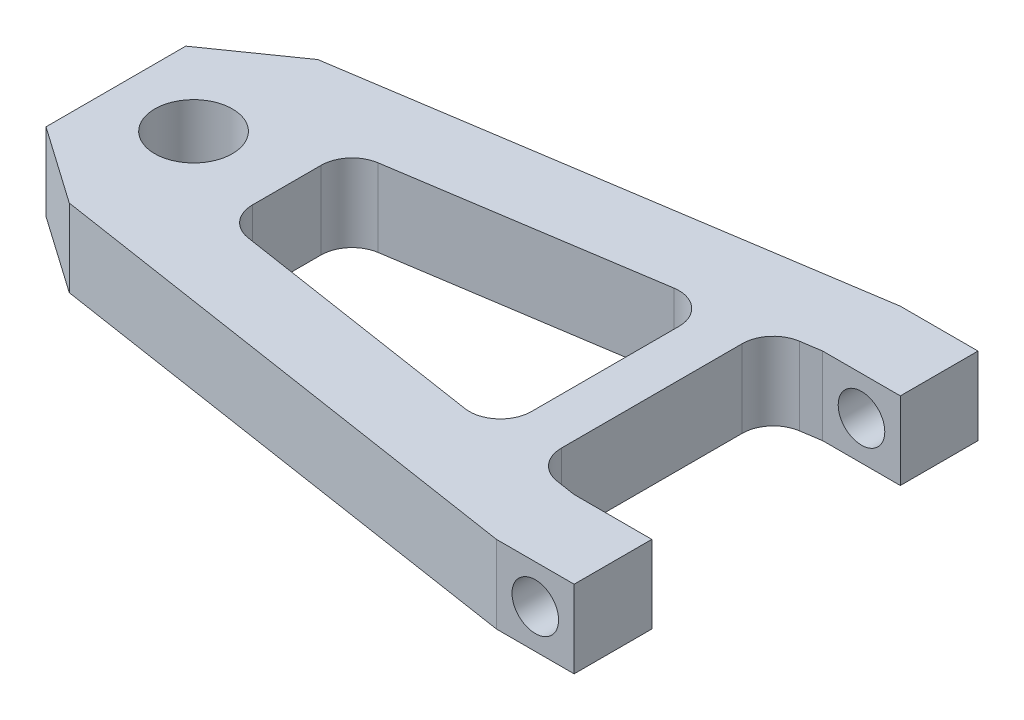
from build123d import *

# Parameters (mm, degrees)
SKETCH1_R           = 2.5
BOSS_EXTRUDE1_DEPTH = 5
SKETCH2_R           = 1.5
CUT_EXTRUDE1_DEPTH  = 46.904792778


with BuildPart() as part:
    # Sketch1 → Boss-Extrude1 (new body)
    with BuildSketch(Plane(origin=(0, 0, 0), x_dir=(1, 0, 0), z_dir=(0, 1, 0))):
        with BuildLine():
            Line((0, 8), (-5, 4.498962309))
            Line((-5, 4.498962309), (-5, -4.498962309))
            Line((-5, -4.498962309), (0, -8))
            Line((0, -8), (32.5, -13))
            Line((32.5, -13), (37.5, -13))
            Line((37.5, -13), (37.5, -8))
            Line((37.5, -8), (32.5, -8))
            Line((32.5, -8), (31.195885631, -7.79936702))
            ThreePointArc((31.195885631, -7.79936702), (29.98206905, -7.124885362), (29.5, -5.822623625))
            Line((29.5, -5.822623625), (29.5, 5.822623625))
            ThreePointArc((29.5, 5.822623625), (29.98206905, 7.124885362), (31.195885631, 7.79936702))
            Line((31.195885631, 7.79936702), (32.5, 8))
            Line((32.5, 8), (37.5, 8))
            Line((37.5, 8), (37.5, 13))
            Line((37.5, 13), (32.5, 13))
            Line((32.5, 13), (0, 8))
        make_face()
        with Locations(Location((0, 0, 0), (0, 0, 270))):
            Circle(SKETCH1_R, mode=Mode.SUBTRACT)
        with BuildLine():
            Line((6, 2.20723901), (6, -2.20723901))
            ThreePointArc((6, -2.20723901), (6.48206905, -3.509500746), (7.695885631, -4.183982405))
            Line((7.695885631, -4.183982405), (24.195885631, -6.722443943))
            ThreePointArc((24.195885631, -6.722443943), (25.802261737, -6.263631498), (26.5, -4.745700548))
            Line((26.5, -4.745700548), (26.5, 4.745700548))
            ThreePointArc((26.5, 4.745700548), (25.802261737, 6.263631498), (24.195885631, 6.722443943))
            Line((24.195885631, 6.722443943), (7.695885631, 4.183982405))
            ThreePointArc((7.695885631, 4.183982405), (6.48206905, 3.509500746), (6, 2.20723901))
        make_face(mode=Mode.SUBTRACT)
    extrude(amount=BOSS_EXTRUDE1_DEPTH)

    # Sketch2 → Cut-Extrude1 (cut, through all)
    with BuildSketch(Plane.XY.offset(13)):
        with Locations((35, 2.5)):
            Circle(SKETCH2_R)
    extrude(amount=-CUT_EXTRUDE1_DEPTH, mode=Mode.SUBTRACT)


solid = part.part
